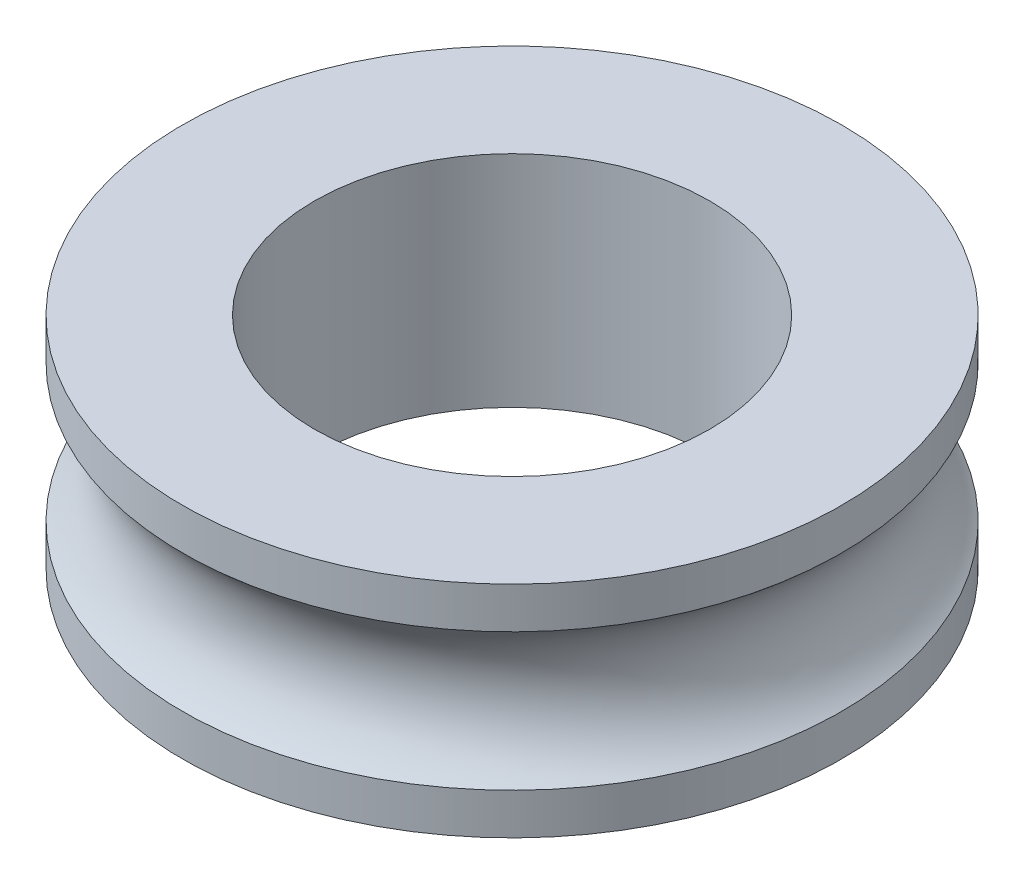
from build123d import *

# Parameters (mm, degrees)
IZIM2_R               = 0.9
KES_EKSTR_ZYON1_DEPTH = 1


with BuildPart() as part:
    # Çizim1 → Döndür1 (revolve)
    with BuildSketch(Plane.XY, mode=Mode.PRIVATE) as d_nd_r1_sk:
        with BuildLine():
            Line((0, 0), (0, 0.5))
            Line((0, 0.5), (1.5, 0.5))
            Line((1.5, 0.5), (1.5, 0.3122499))
            ThreePointArc((1.5, 0.3122499), (1.35, 0), (1.5, -0.3122499))
            Line((1.5, -0.3122499), (1.5, -0.5))
            Line((1.5, -0.5), (0, -0.5))
            Line((0, -0.5), (0, 0))
        make_face()
    revolve(d_nd_r1_sk.sketch.rotate(Axis((0, 0, 0), (0, 1, 0)), 90), axis=Axis((0, 0, 0), (0, 1, 0)))

    # Çizim2 → Kes-Ekstrüzyon1 (cut)
    with BuildSketch(Plane(origin=(0, 0.5, 0), x_dir=(1, 0, 0), z_dir=(0, 1, 0))):
        with Locations(Location((0, 0, 0), (0, 0, 270))):
            Circle(IZIM2_R)
    extrude(amount=-KES_EKSTR_ZYON1_DEPTH, mode=Mode.SUBTRACT)


solid = part.part
